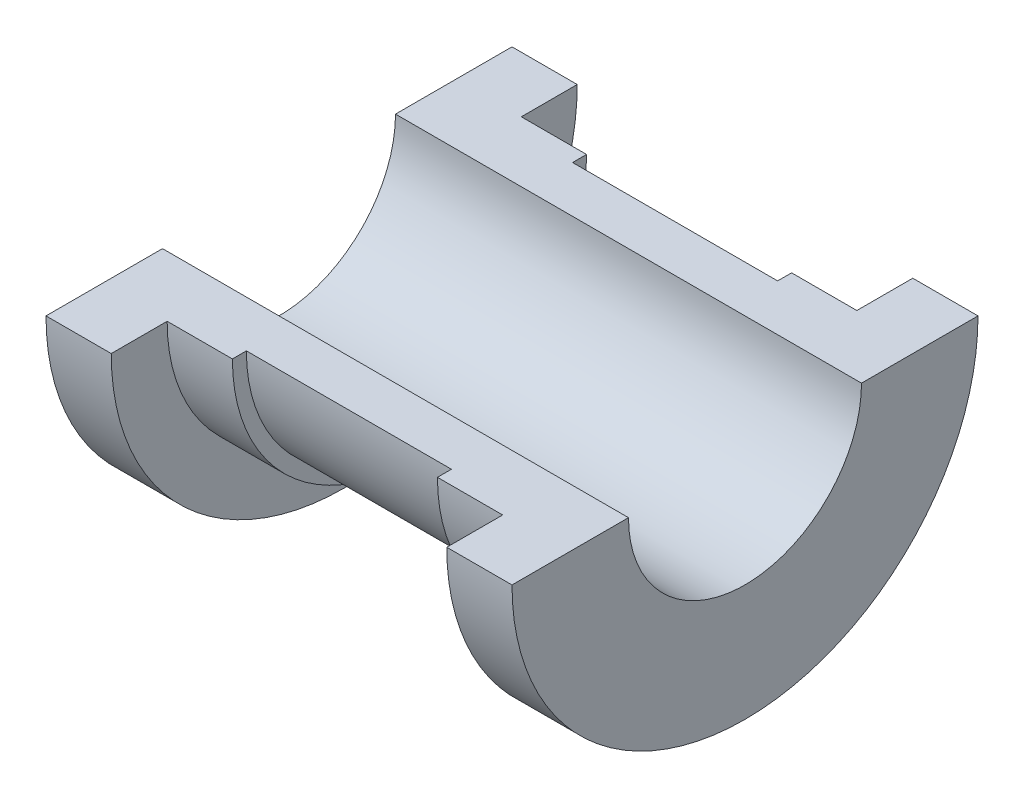
from build123d import *

# Parameters (mm, degrees)
SKETCH2_R               = 12.5
CUT_EXTRUDE1_DEPTH      = 62.23724357
CUT_EXTRUDE4_DEPTH      = 62.23724357
CUT_EXTRUDE4_DEPTH_BACK = 62.23724357
SKETCH5_R               = 3
BOSS_EXTRUDE1_DEPTH     = 5


with BuildPart() as part:
    # Sketch1 → Revolve1 (revolve)
    with BuildSketch(Plane.XY, mode=Mode.PRIVATE) as revolve1_sk:
        Polygon((-25, 0), (25, 0), (25, 25), (18, 25), (18, 19), (11, 19), (11, 17.5), (-11, 17.5), (-11, 19), (-18, 19), (-18, 25), (-25, 25), align=None)
    revolve(revolve1_sk.sketch.rotate(Axis((-25, 0, 0), (1, 0, 0)), 180), axis=Axis((-25, 0, 0), (1, 0, 0)))

    # Sketch2 → Cut-Extrude1 (cut, through all)
    with BuildSketch(Plane.ZY.offset(25)):
        with Locations(Location((0, 0, 0), (0, 0, 270))):
            Circle(SKETCH2_R)
    extrude(amount=-CUT_EXTRUDE1_DEPTH, mode=Mode.SUBTRACT)

    # Sketch3 → Cut-Extrude4 (cut, two sides: drawn at the far end of the back side and taken through both)
    with BuildSketch(Plane.ZY.offset(25).offset(-CUT_EXTRUDE4_DEPTH_BACK)):
        Polygon((-146.803398875, 0), (-25, 0), (25, 0), (146.803398875, 0), (146.803398875, 243.60679775), (-146.803398875, 243.60679775), align=None)
    extrude(amount=CUT_EXTRUDE4_DEPTH + CUT_EXTRUDE4_DEPTH_BACK, mode=Mode.SUBTRACT)


with BuildPart() as body_2:
    # Sketch5 → Boss-Extrude1 (new body)
    with BuildSketch(Plane(origin=(0, -17.5, 0), x_dir=(1, 0, 0), z_dir=(0, 1, 0))):
        with Locations(Location((0, 0, 0), (0, 0, 270))):
            Circle(SKETCH5_R)
    extrude(amount=-BOSS_EXTRUDE1_DEPTH)


solid = Compound([part.part, body_2.part])
